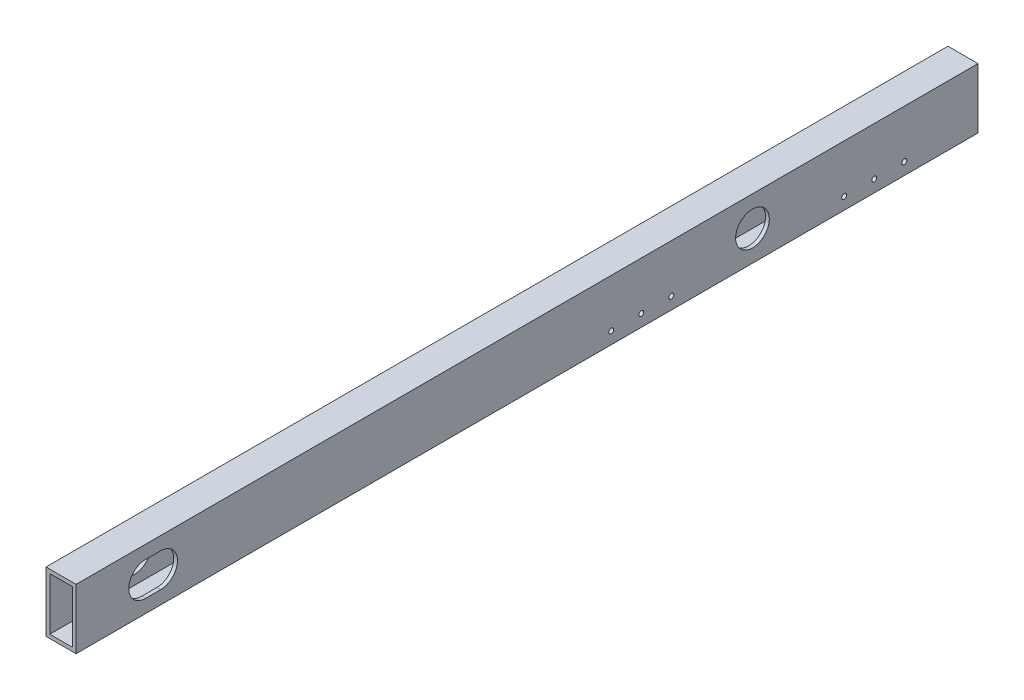
from build123d import *

# Parameters (mm, degrees)
SKETCH1_W           = 25.4
SKETCH1_H           = 50.8
SKETCH1_W_2         = 19.05
SKETCH1_H_2         = 44.45
BOSS_EXTRUDE1_DEPTH = 762
CUT_EXTRUDE1_REACH  = 764.846
SKETCH4_R           = 14.224
SKETCH5_R           = 2.0955
CUT_EXTRUDE2_DEPTH  = 3.175
CUT_EXTRUDE3_REACH  = 764.846
SKETCH7_R           = 2.0955


with BuildPart() as part:
    # Sketch1 → Boss-Extrude1 (new body)
    with BuildSketch(Plane.XY):
        Rectangle(SKETCH1_W, SKETCH1_H)
        Rectangle(SKETCH1_W_2, SKETCH1_H_2, mode=Mode.SUBTRACT)
    extrude(amount=BOSS_EXTRUDE1_DEPTH)

    # Cut-Extrude1: up to this face of the body (flat: up to its plane)
    cut_extrude1_end = Plane(part.part.faces().sort_by_distance((-12.7, 0, 381))[0])
    # Sketch4 → Cut-Extrude1 (cut, up to the picked face)
    with BuildSketch(Plane(origin=(12.7, 0, 0), x_dir=(0, 0, -1), z_dir=(1, 0, 0)), mode=Mode.PRIVATE) as cut_extrude1_sk1:
        with Locations(Location((-190.549048411, 0, 0), (0, 0, 90))):
            Circle(SKETCH4_R)
    cut_extrude1_tool1 = split(extrude(cut_extrude1_sk1.sketch, amount=-CUT_EXTRUDE1_REACH, mode=Mode.PRIVATE), bisect_by=cut_extrude1_end, keep=Keep.BOTH, mode=Mode.PRIVATE)
    # Sketch4 → Cut-Extrude1 (cut, up to the picked face)
    with BuildSketch(Plane(origin=(12.7, 0, 0), x_dir=(0, 0, -1), z_dir=(1, 0, 0)), mode=Mode.PRIVATE) as cut_extrude1_sk2:
        with BuildLine():
            Line((-703.248048411, 14.224), (-690.548048411, 14.224))
            ThreePointArc((-690.548048411, 14.224), (-676.324048411, 0), (-690.548048411, -14.224))
            Line((-690.548048411, -14.224), (-703.248048411, -14.224))
            ThreePointArc((-703.248048411, -14.224), (-717.472048411, 0), (-703.248048411, 14.224))
        make_face()
    cut_extrude1_tool2 = split(extrude(cut_extrude1_sk2.sketch, amount=-CUT_EXTRUDE1_REACH, mode=Mode.PRIVATE), bisect_by=cut_extrude1_end, keep=Keep.BOTH, mode=Mode.PRIVATE)
    add(cut_extrude1_tool1.solids().sort_by(Axis((12.7, 0, 190.549048), (-1, 0, 0)))[0], mode=Mode.SUBTRACT)
    add(cut_extrude1_tool2.solids().sort_by(Axis((12.7, 0, 696.898048), (-1, 0, 0)))[0], mode=Mode.SUBTRACT)

    # Sketch5 → Cut-Extrude2 (cut)
    with BuildSketch(Plane.XZ.offset(25.4)):
        with Locations(Location((2.54, 264.16, 0), (0, 0, 270))):
            Circle(SKETCH5_R)
        with Locations(Location((2.54, 289.56, 0), (0, 0, 270))):
            Circle(SKETCH5_R)
        with Locations(Location((2.54, 314.96, 0), (0, 0, 270))):
            Circle(SKETCH5_R)
        with Locations(Location((-2.54, 264.16, 0), (0, 0, 180))):
            Circle(SKETCH5_R)
        with Locations(Location((-2.54, 289.56, 0), (0, 0, 180))):
            Circle(SKETCH5_R)
        with Locations(Location((-2.54, 314.96, 0), (0, 0, 180))):
            Circle(SKETCH5_R)
    extrude(amount=-CUT_EXTRUDE2_DEPTH, mode=Mode.SUBTRACT)

    # Cut-Extrude3: up to this face of the body (flat: up to its plane)
    cut_extrude3_end = Plane(part.part.faces().sort_by_distance((-12.7, 0, 375.771255471))[0])
    # Sketch7 → Cut-Extrude3 (cut, up to the picked face)
    with BuildSketch(Plane(origin=(12.7, 0, 0), x_dir=(0, 0, -1), z_dir=(1, 0, 0)), mode=Mode.PRIVATE) as cut_extrude3_sk1:
        with Locations(Location((-259.08, -15.24, 0), (0, 0, 90))):
            Circle(SKETCH7_R)
    cut_extrude3_tool1 = split(extrude(cut_extrude3_sk1.sketch, amount=-CUT_EXTRUDE3_REACH, mode=Mode.PRIVATE), bisect_by=cut_extrude3_end, keep=Keep.BOTH, mode=Mode.PRIVATE)
    # Sketch7 → Cut-Extrude3 (cut, up to the picked face)
    with BuildSketch(Plane(origin=(12.7, 0, 0), x_dir=(0, 0, -1), z_dir=(1, 0, 0)), mode=Mode.PRIVATE) as cut_extrude3_sk2:
        with Locations(Location((-284.48, -15.24, 0), (0, 0, 90))):
            Circle(SKETCH7_R)
    cut_extrude3_tool2 = split(extrude(cut_extrude3_sk2.sketch, amount=-CUT_EXTRUDE3_REACH, mode=Mode.PRIVATE), bisect_by=cut_extrude3_end, keep=Keep.BOTH, mode=Mode.PRIVATE)
    # Sketch7 → Cut-Extrude3 (cut, up to the picked face)
    with BuildSketch(Plane(origin=(12.7, 0, 0), x_dir=(0, 0, -1), z_dir=(1, 0, 0)), mode=Mode.PRIVATE) as cut_extrude3_sk3:
        with Locations(Location((-309.88, -15.24, 0), (0, 0, 90))):
            Circle(SKETCH7_R)
    cut_extrude3_tool3 = split(extrude(cut_extrude3_sk3.sketch, amount=-CUT_EXTRUDE3_REACH, mode=Mode.PRIVATE), bisect_by=cut_extrude3_end, keep=Keep.BOTH, mode=Mode.PRIVATE)
    # Sketch7 → Cut-Extrude3 (cut, up to the picked face)
    with BuildSketch(Plane(origin=(12.7, 0, 0), x_dir=(0, 0, -1), z_dir=(1, 0, 0)), mode=Mode.PRIVATE) as cut_extrude3_sk4:
        with Locations(Location((-87.63, -15.24, 0), (0, 0, 90))):
            Circle(SKETCH7_R)
    cut_extrude3_tool4 = split(extrude(cut_extrude3_sk4.sketch, amount=-CUT_EXTRUDE3_REACH, mode=Mode.PRIVATE), bisect_by=cut_extrude3_end, keep=Keep.BOTH, mode=Mode.PRIVATE)
    # Sketch7 → Cut-Extrude3 (cut, up to the picked face)
    with BuildSketch(Plane(origin=(12.7, 0, 0), x_dir=(0, 0, -1), z_dir=(1, 0, 0)), mode=Mode.PRIVATE) as cut_extrude3_sk5:
        with Locations(Location((-62.23, -15.24, 0), (0, 0, 90))):
            Circle(SKETCH7_R)
    cut_extrude3_tool5 = split(extrude(cut_extrude3_sk5.sketch, amount=-CUT_EXTRUDE3_REACH, mode=Mode.PRIVATE), bisect_by=cut_extrude3_end, keep=Keep.BOTH, mode=Mode.PRIVATE)
    # Sketch7 → Cut-Extrude3 (cut, up to the picked face)
    with BuildSketch(Plane(origin=(12.7, 0, 0), x_dir=(0, 0, -1), z_dir=(1, 0, 0)), mode=Mode.PRIVATE) as cut_extrude3_sk6:
        with Locations(Location((-113.03, -15.24, 0), (0, 0, 90))):
            Circle(SKETCH7_R)
    cut_extrude3_tool6 = split(extrude(cut_extrude3_sk6.sketch, amount=-CUT_EXTRUDE3_REACH, mode=Mode.PRIVATE), bisect_by=cut_extrude3_end, keep=Keep.BOTH, mode=Mode.PRIVATE)
    add(cut_extrude3_tool1.solids().sort_by(Axis((12.7, -15.24, 259.08), (-1, 0, 0)))[0], mode=Mode.SUBTRACT)
    add(cut_extrude3_tool2.solids().sort_by(Axis((12.7, -15.24, 284.48), (-1, 0, 0)))[0], mode=Mode.SUBTRACT)
    add(cut_extrude3_tool3.solids().sort_by(Axis((12.7, -15.24, 309.88), (-1, 0, 0)))[0], mode=Mode.SUBTRACT)
    add(cut_extrude3_tool4.solids().sort_by(Axis((12.7, -15.24, 87.63), (-1, 0, 0)))[0], mode=Mode.SUBTRACT)
    add(cut_extrude3_tool5.solids().sort_by(Axis((12.7, -15.24, 62.23), (-1, 0, 0)))[0], mode=Mode.SUBTRACT)
    add(cut_extrude3_tool6.solids().sort_by(Axis((12.7, -15.24, 113.03), (-1, 0, 0)))[0], mode=Mode.SUBTRACT)


solid = part.part
